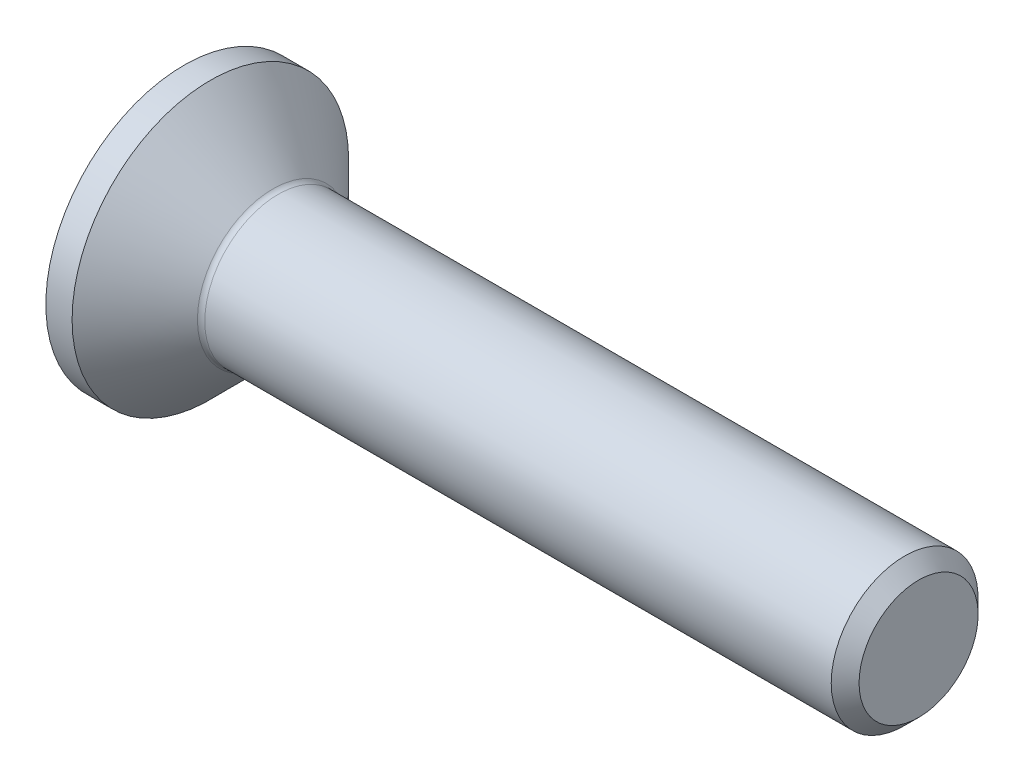
from build123d import *

# Parameters (mm, degrees)
HEXAGONSOCKET_DEPTH = 1.5
HEADFILLET_R        = 0.2
CHAMFER_2_SIZE      = 0.379
SKETCH4_W           = 5
SKETCH4_H           = 5


with BuildPart() as part:
    # Sketch1 → Base (revolve)
    with BuildSketch(Plane.XY, mode=Mode.PRIVATE) as base_sk:
        Polygon((0, 0), (0, 4.48), (2.48, 2), (20, 2), (20, 0), align=None)
    revolve(base_sk.sketch.rotate(Axis((-0.587069181, 0, 0), (1, 0, 0)), 90), axis=Axis((-0.587069181, 0, 0), (1, 0, 0)))

    # Sketch2 → HexagonSocket (cut)
    with BuildSketch(Plane(origin=(0, 0, 0), x_dir=(0, 0, -1), z_dir=(1, 0, 0))):
        Polygon((1.443375673, 0), (0.721687836, 1.25), (-0.721687836, 1.25), (-1.443375673, 0), (-0.721687836, -1.25), (0.721687836, -1.25), align=None)
    extrude(amount=HEXAGONSOCKET_DEPTH, mode=Mode.SUBTRACT)

    # Sketch3 → Cut-Revolve1 (revolve, cut)
    with BuildSketch(Plane.XY, mode=Mode.PRIVATE) as cut_revolve1_sk:
        Polygon((1.5, 1.25), (2.221687836, 0), (1.5, 0), align=None)
    revolve(cut_revolve1_sk.sketch.rotate(Axis((-0.439109555, 0, 0), (1, 0, 0)), 90), axis=Axis((-0.439109555, 0, 0), (1, 0, 0)), mode=Mode.SUBTRACT)

    # HeadFillet
    headfillet_edges = [part.edges().sort_by_distance(p)[0] for p in [
        (2.48, 0, -2),
    ]]
    fillet(headfillet_edges, radius=HEADFILLET_R)

    # Chamfer 2
    chamfer_2_edges = [part.edges().sort_by_distance(p)[0] for p in [
        (20, 0, -2),
    ]]
    chamfer(chamfer_2_edges, length=CHAMFER_2_SIZE)

    # Sketch4 → Cut-Revolve2 (revolve, cut)
    with BuildSketch(Plane(origin=(0, 0, 0), x_dir=(1, 0, 0), z_dir=(0, 1, 0)), mode=Mode.PRIVATE) as cut_revolve2_sk:
        with Locations((0.5, 6.265)):
            Rectangle(SKETCH4_W, SKETCH4_H)
    revolve(cut_revolve2_sk.sketch.rotate(Axis((11.853138686, 0, 0), (-1, 0, 0)), 180), axis=Axis((11.853138686, 0, 0), (-1, 0, 0)), mode=Mode.SUBTRACT)


solid = part.part
